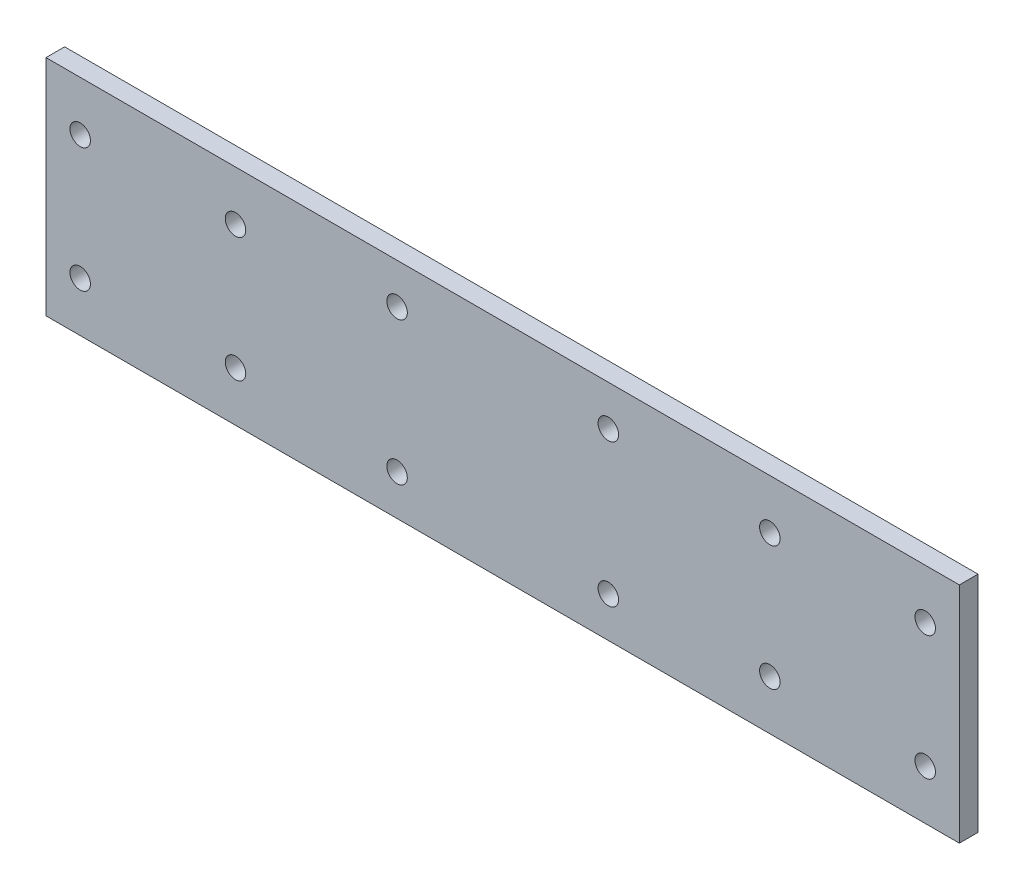
from build123d import *

# Parameters (mm, degrees)
SKETCH_1_W                  = 147
SKETCH_1_H                  = 36
EXTRUDE_1_DEPTH             = 3
HOLE_WIZARD_M4_2_AT_2_COUNT = 2
HOLE_WIZARD_M4_2_AT_2_PITCH = 25


with BuildPart() as part:
    # 草图1 → 凸台-拉伸1 (new body)
    with BuildSketch(Plane.XY):
        Rectangle(SKETCH_1_W, SKETCH_1_H)
    extrude(amount=EXTRUDE_1_DEPTH)

    # 草图3 → M4 螺纹孔的螺纹孔钻头1 (revolve, cut)
    with BuildSketch(Plane(origin=(-17, 11.5, 3), x_dir=(0, -1, 0), z_dir=(1, 0, 0))):
        Polygon((0, 0), (0, 10.991420021), (1.65, 10), (1.65, 0), align=None)
    hole_wizard_m4_1 = revolve(axis=Axis((-17, 11.5, 9.35), (0, 0, -1)), mode=Mode.SUBTRACT)

    # 镜向1: M4 螺纹孔的螺纹孔钻头1 across plane
    add(hole_wizard_m4_1.mirror(Plane.ZX), mode=Mode.SUBTRACT)

    # 镜向2: M4 螺纹孔的螺纹孔钻头1 across plane
    add(hole_wizard_m4_1.mirror(Plane(origin=(0, 0, 0), x_dir=(0, 0, 1), z_dir=(1, 0, 0))), mode=Mode.SUBTRACT)

    # 镜向2 copy 1 sketch → 镜向2 copy 1 (revolve, cut)
    with BuildSketch(Plane(origin=(17, -11.5, 3), x_dir=(0, 1, 0), z_dir=(-1, 0, 0))):
        Polygon((0, 0), (0, 10.991420021), (1.65, 10), (1.65, 0), align=None)
    revolve(axis=Axis((17, -11.5, 9.35), (0, 0, -1)), mode=Mode.SUBTRACT)

    # 草图5 → M4 螺纹孔的螺纹孔钻头2 (revolve, cut)
    with BuildSketch(Plane(origin=(-68, -10, 3), x_dir=(0, -1, 0), z_dir=(1, 0, 0))):
        Polygon((0, 0), (0, 10.991420021), (1.65, 10), (1.65, 0), align=None)
    hole_wizard_m4_2 = revolve(axis=Axis((-68, -10, 9.35), (0, 0, -1)), mode=Mode.SUBTRACT)

    # M4 螺纹孔的螺纹孔钻头2 at 2: M4 螺纹孔的螺纹孔钻头2 ×2
    with Locations(*[(i * HOLE_WIZARD_M4_2_AT_2_PITCH, 0, 0) for i in range(1, HOLE_WIZARD_M4_2_AT_2_COUNT)]):
        add(hole_wizard_m4_2, mode=Mode.SUBTRACT)

    # 镜向3: M4 螺纹孔的螺纹孔钻头2 across plane
    add(hole_wizard_m4_2.mirror(Plane.ZX), mode=Mode.SUBTRACT)

    # 镜向3 copy 1 sketch → 镜向3 copy 1 (revolve, cut)
    with BuildSketch(Plane(origin=(-43, 10, 3), x_dir=(0, 1, 0), z_dir=(1, 0, 0))):
        Polygon((0, 0), (0, -10.991420021), (1.65, -10), (1.65, 0), align=None)
    revolve(axis=Axis((-43, 10, 9.35), (0, 0, 1)), mode=Mode.SUBTRACT)

    # 镜向4: M4 螺纹孔的螺纹孔钻头2 across plane
    add(hole_wizard_m4_2.mirror(Plane(origin=(0, 0, 0), x_dir=(0, 0, 1), z_dir=(1, 0, 0))), mode=Mode.SUBTRACT)

    # 镜向4 copy 1 sketch → 镜向4 copy 1 (revolve, cut)
    with BuildSketch(Plane(origin=(43, -10, 3), x_dir=(0, -1, 0), z_dir=(-1, 0, 0))):
        Polygon((0, 0), (0, -10.991420021), (1.65, -10), (1.65, 0), align=None)
    revolve(axis=Axis((43, -10, 9.35), (0, 0, 1)), mode=Mode.SUBTRACT)

    # 镜向4 copy 2 sketch → 镜向4 copy 2 (revolve, cut)
    with BuildSketch(Plane(origin=(68, 10, 3), x_dir=(0, 1, 0), z_dir=(-1, 0, 0))):
        Polygon((0, 0), (0, 10.991420021), (1.65, 10), (1.65, 0), align=None)
    revolve(axis=Axis((68, 10, 9.35), (0, 0, -1)), mode=Mode.SUBTRACT)

    # 镜向4 copy 3 sketch → 镜向4 copy 3 (revolve, cut)
    with BuildSketch(Plane(origin=(43, 10, 3), x_dir=(0, 1, 0), z_dir=(-1, 0, 0))):
        Polygon((0, 0), (0, 10.991420021), (1.65, 10), (1.65, 0), align=None)
    revolve(axis=Axis((43, 10, 9.35), (0, 0, -1)), mode=Mode.SUBTRACT)


solid = part.part
